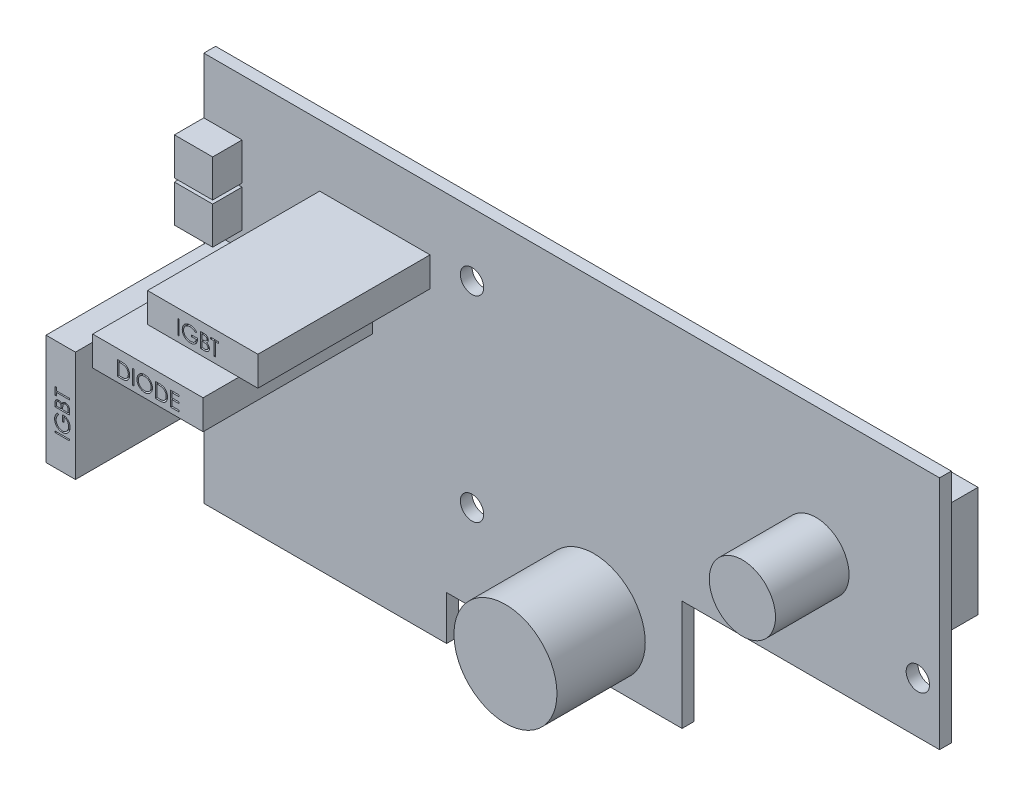
from build123d import *

# Parameters (mm, degrees)
BOSS_EXTRUDE1_DEPTH = 1.6
SKETCH2_W           = 5
SKETCH2_H           = 15
BOSS_EXTRUDE2_DEPTH = 10
SKETCH3_R           = 1.5875
CUT_EXTRUDE1_DEPTH  = 114.769767513
SKETCH4_R           = 4.5
BOSS_EXTRUDE3_DEPTH = 10
SKETCH5_R           = 7
BOSS_EXTRUDE4_DEPTH = 12
SKETCH6_W           = 15
SKETCH6_H           = 4
SKETCH6_W_2         = 4
SKETCH6_H_2         = 15
BOSS_EXTRUDE5_DEPTH = 23.4
SKETCH7_W           = 0.179487179
SKETCH7_H           = 2
CUT_EXTRUDE2_DEPTH  = 1
SKETCH8_W           = 2
SKETCH8_H           = 0.17948718
CUT_EXTRUDE3_DEPTH  = 1
SKETCH9_W           = 15
SKETCH9_H           = 4
BOSS_EXTRUDE6_DEPTH = 23
SKETCH10_W          = 0.17948718
SKETCH10_H          = 2
CUT_EXTRUDE4_DEPTH  = 1
SKETCH11_W          = 5.2
SKETCH11_H          = 5.075
BOSS_EXTRUDE7_DEPTH = 4
CUT_EXTRUDE5_DEPTH  = 1


with BuildPart() as part:
    # Sketch1 → Boss-Extrude1 (new body)
    with BuildSketch(Plane.XY):
        Polygon((33, -53), (33, -47), (65, -47), (65, -32), (100, -32), (100, 0), (65, 0), (33, 0), (0, 0), (0, -53), align=None)
    extrude(amount=BOSS_EXTRUDE1_DEPTH)

    # Sketch2 → Boss-Extrude2 (add)
    with BuildSketch(Plane(origin=(0, 0, 0), x_dir=(-1, 0, 0), z_dir=(0, 0, -1))):
        with Locations((-91.125, -17.6)):
            Rectangle(SKETCH2_W, SKETCH2_H)
    extrude(amount=BOSS_EXTRUDE2_DEPTH)

    # Sketch3 → Cut-Extrude1 (cut, through all)
    with BuildSketch(Plane.XY.offset(1.6)):
        with Locations((97.05, -25.05)):
            Circle(SKETCH3_R)
        with Locations((36.45, -8.6)):
            Circle(SKETCH3_R)
        with Locations((36.45, -35.276)):
            Circle(SKETCH3_R)
    extrude(amount=-CUT_EXTRUDE1_DEPTH, mode=Mode.SUBTRACT)

    # Sketch4 → Boss-Extrude3 (add)
    with BuildSketch(Plane.XY.offset(1.6)):
        with Locations((83.2, -17.55)):
            Circle(SKETCH4_R)
    extrude(amount=BOSS_EXTRUDE3_DEPTH)

    # Sketch5 → Boss-Extrude4 (add)
    with BuildSketch(Plane.XY.offset(1.6)):
        with Locations((53, -39.4)):
            Circle(SKETCH5_R)
    extrude(amount=BOSS_EXTRUDE4_DEPTH)

    # Sketch6 → Boss-Extrude5 (add)
    with BuildSketch(Plane.XY.offset(1.6)):
        with Locations((23.25, -10.374)):
            Rectangle(SKETCH6_W, SKETCH6_H)
        with Locations((3.95, -28.026)):
            Rectangle(SKETCH6_W_2, SKETCH6_H_2)
    extrude(amount=BOSS_EXTRUDE5_DEPTH)

    # Sketch7 → Cut-Extrude2 (cut)
    # profile 1 of 4: a face of its own
    with BuildSketch(Plane.XY.offset(25)):
        with Locations((19.967129928, -10.584645083)):
            Rectangle(SKETCH7_W, SKETCH7_H)
    # profile 2 of 4: a face of its own
    with BuildSketch(Plane.XY.offset(25)):
        with BuildLine():
            Line((22.441488902, -9.925991236), (22.287642748, -10.07182457))
            add(Edge.make_bspline(
                [(22.287642748, -10.07182457), (22.259803383, -10.045635505), (22.2047885, -9.993881869), (22.115096932, -9.926732729), (22.021517713, -9.869209243), (21.924539143, -9.82240568), (21.826562827, -9.785061245), (21.72888924, -9.758473736), (21.632520268, -9.741518001), (21.568424715, -9.739490361), (21.536841466, -9.738491236)],
                knots=[0, 0, 0, 0, 1.08915593, 2.152340314, 3.188132944, 4.216796309, 5.218260357, 6.173443236, 7.099959455, 8, 8, 8, 8], degree=3))
            add(Edge.make_bspline(
                [(21.536841466, -9.738491236), (21.517461637, -9.738727583), (21.478752243, -9.739199662), (21.421253989, -9.745224928), (21.364358768, -9.753890565), (21.308173982, -9.76642878), (21.25259039, -9.782319672), (21.197801309, -9.802197079), (21.143704535, -9.825371504), (21.090809631, -9.852150061), (21.039529343, -9.881567116), (20.991096866, -9.914166282), (20.945203495, -9.948902733), (20.902711824, -9.98664615), (20.863377431, -10.027054645), (20.826264076, -10.069376534), (20.79267705, -10.114768087), (20.762339241, -10.162394159), (20.735275459, -10.211418268), (20.7113848, -10.261368547), (20.691329321, -10.312079321), (20.675461061, -10.363614223), (20.662369259, -10.41557456), (20.653159197, -10.468320114), (20.647966785, -10.521907363), (20.647068625, -10.557791511), (20.646617107, -10.57583098)],
                knots=[0, 0, 0, 0, 1.02818874, 2.053710826, 3.065248034, 4.081641283, 5.106893873, 6.131558223, 7.173050175, 8.228653731, 9.27666206, 10.308777013, 11.325269123, 12.329503258, 13.32196095, 14.316845687, 15.314881793, 16.315733098, 17.311955233, 18.285320748, 19.252783886, 20.203351036, 21.145449891, 22.095197417, 23.042428769, 24, 24, 24, 24], degree=3))
            add(Edge.make_bspline(
                [(20.646617107, -10.57583098), (20.647048946, -10.594271447), (20.647911445, -10.631102026), (20.653431627, -10.686070068), (20.663676336, -10.740221726), (20.67737217, -10.793734945), (20.694504065, -10.846701373), (20.715859874, -10.898891378), (20.741154503, -10.95030303), (20.770432532, -11.000473097), (20.802538934, -11.049343396), (20.838506409, -11.095377409), (20.876712457, -11.139188138), (20.918548971, -11.179802861), (20.962674424, -11.218307944), (21.010407153, -11.253642528), (21.060808559, -11.286487227), (21.113955537, -11.316428095), (21.169271413, -11.34317583), (21.225989557, -11.366960914), (21.284291166, -11.386549106), (21.343869846, -11.402513737), (21.404654573, -11.415599621), (21.466953889, -11.424018181), (21.530309722, -11.430127228), (21.573017512, -11.430573896), (21.594533774, -11.430798929)],
                knots=[0, 0, 0, 0, 0.93586088, 1.869166235, 2.799637598, 3.729985548, 4.670839027, 5.622275134, 6.589130586, 7.576015415, 8.568469353, 9.55398029, 10.53834874, 11.515998671, 12.510579167, 13.508179873, 14.527009472, 15.561807829, 16.601455013, 17.643573243, 18.680854198, 19.719860599, 20.772568776, 21.833555941, 22.908541556, 24, 24, 24, 24], degree=3))
            add(Edge.make_bspline(
                [(21.594533774, -11.430798929), (21.620464258, -11.430256885), (21.671382976, -11.429192494), (21.746232372, -11.420906615), (21.818119841, -11.40796559), (21.886843386, -11.389013649), (21.952482826, -11.36484012), (22.015278793, -11.3356999), (22.074736883, -11.300475294), (22.13103584, -11.260718799), (22.182897088, -11.216424609), (22.229670874, -11.168627777), (22.270611153, -11.117560311), (22.306328124, -11.063522988), (22.335875927, -11.006068528), (22.360128952, -10.945478492), (22.378719405, -10.881725628), (22.386350819, -10.837673267), (22.390206851, -10.815414313)],
                knots=[0, 0, 0, 0, 1.13008108, 2.219097802, 3.278683437, 4.311054135, 5.322181354, 6.324827112, 7.324222904, 8.330512327, 9.32562643, 10.293043162, 11.24128371, 12.174520618, 13.111833804, 14.052305215, 15.015860969, 16, 16, 16, 16], degree=3))
            Line((22.390206851, -10.815414313), (21.723540184, -10.815414313))
            Line((21.723540184, -10.815414313), (21.723540184, -10.610286108))
            Line((21.723540184, -10.610286108), (22.56969403, -10.610286108))
            add(Edge.make_bspline(
                [(22.56969403, -10.610286108), (22.56871926, -10.648518959), (22.566811458, -10.723347554), (22.55342922, -10.832473423), (22.531819784, -10.935542962), (22.502299606, -11.032664718), (22.46408516, -11.123701056), (22.417586573, -11.208744408), (22.362059646, -11.287245369), (22.299482251, -11.3598448), (22.229253704, -11.424604349), (22.153271635, -11.481522028), (22.071410511, -11.52946638), (21.983747763, -11.568472473), (21.890570373, -11.598914755), (21.791662727, -11.620498514), (21.687158955, -11.633429921), (21.615537997, -11.635082138), (21.578908774, -11.635927134)],
                knots=[0, 0, 0, 0, 1.140356446, 2.231883559, 3.274166699, 4.278491846, 5.25512956, 6.21435461, 7.1637429, 8.11826594, 9.068280886, 10.0076534, 10.945064095, 11.891975133, 12.864533718, 13.863980011, 14.907571808, 16, 16, 16, 16], degree=3))
            add(Edge.make_bspline(
                [(21.578908774, -11.635927134), (21.556331553, -11.635601922), (21.511801999, -11.634960499), (21.446035754, -11.630402014), (21.382082828, -11.623384542), (21.319952537, -11.612787329), (21.259416342, -11.599807526), (21.200776579, -11.583186544), (21.143809869, -11.563947288), (21.088428163, -11.542064046), (21.035134136, -11.516708813), (20.983690412, -11.488531876), (20.933812626, -11.457678527), (20.885840532, -11.423615187), (20.839524177, -11.386596638), (20.795162209, -11.346548685), (20.752506279, -11.303593759), (20.725786014, -11.273091468), (20.712322235, -11.257722006)],
                knots=[0, 0, 0, 0, 1.107784379, 2.184907829, 3.233506516, 4.263428166, 5.276301166, 6.270063455, 7.25232949, 8.225834625, 9.190232166, 10.146266622, 11.1027726, 12.066435141, 13.031522626, 14.010570082, 14.99756817, 16, 16, 16, 16], degree=3))
            add(Edge.make_bspline(
                [(20.712322235, -11.257722006), (20.692787417, -11.233338775), (20.654042038, -11.184977051), (20.604168806, -11.107491369), (20.561653719, -11.027261734), (20.52715782, -10.944064804), (20.500221771, -10.857978397), (20.480903912, -10.769112516), (20.469585461, -10.677352727), (20.467954868, -10.61525829), (20.467129927, -10.583843801)],
                knots=[0, 0, 0, 0, 1.023165419, 2.029347347, 3.013907458, 3.994755782, 4.975994455, 5.96558838, 6.970761222, 8, 8, 8, 8], degree=3))
            add(Edge.make_bspline(
                [(20.467129927, -10.583843801), (20.467434064, -10.560320228), (20.46803847, -10.513572052), (20.475367337, -10.444167876), (20.485882433, -10.375996052), (20.501337892, -10.309112306), (20.520821472, -10.243471968), (20.54513775, -10.17904456), (20.573449119, -10.115792062), (20.606355117, -10.054149851), (20.642974808, -9.994935901), (20.682717791, -9.938388585), (20.72614842, -9.885537691), (20.772557448, -9.835713892), (20.822498585, -9.789543122), (20.87550397, -9.746597916), (20.931614452, -9.706820667), (20.991006555, -9.670837904), (21.052793803, -9.638515835), (21.11682809, -9.610179143), (21.183089867, -9.586760105), (21.251082712, -9.566889374), (21.321321283, -9.552195008), (21.393295876, -9.541538582), (21.467381654, -9.534246811), (21.517459385, -9.533660379), (21.542851081, -9.533363031)],
                knots=[0, 0, 0, 0, 1.008945113, 2.00506715, 2.99143336, 3.967273523, 4.948097931, 5.927297278, 6.919902385, 7.919676788, 8.923139349, 9.905703106, 10.883022732, 11.856032218, 12.825136022, 13.798837087, 14.781400844, 15.773989409, 16.776158564, 17.77167057, 18.775803737, 19.789618931, 20.80898985, 21.851988756, 22.910860228, 24, 24, 24, 24], degree=3))
            add(Edge.make_bspline(
                [(21.542851081, -9.533363031), (21.563558649, -9.533694169), (21.604619323, -9.534350778), (21.665719741, -9.538902005), (21.72587575, -9.546115651), (21.785176544, -9.555959529), (21.843420182, -9.569367353), (21.900772585, -9.585412087), (21.957316891, -9.604093128), (22.012875891, -9.626372469), (22.067823157, -9.651660255), (22.122464209, -9.680125067), (22.176612349, -9.712253641), (22.230361481, -9.748141376), (22.284050543, -9.7871719), (22.336830339, -9.830461514), (22.389974878, -9.876303089), (22.424147344, -9.909264337), (22.441488902, -9.925991236)],
                knots=[0, 0, 0, 0, 0.985871117, 1.954866573, 2.915460327, 3.869826059, 4.81536089, 5.759505086, 6.70452669, 7.649098992, 8.607881297, 9.583363685, 10.581137262, 11.603961102, 12.659522466, 13.73993555, 14.853081303, 16, 16, 16, 16], degree=3))
        make_face()
    # profile 3 of 4: a face of its own
    with BuildSketch(Plane.XY.offset(25)):
        with BuildLine():
            Line((22.97995044, -9.584645083), (23.370174799, -9.584645083))
            add(Edge.make_bspline(
                [(23.370174799, -9.584645083), (23.389276787, -9.584745511), (23.426301193, -9.584940167), (23.480140874, -9.5879591), (23.530568766, -9.592075482), (23.577599493, -9.598606964), (23.621211323, -9.606487979), (23.661535687, -9.616031874), (23.698444357, -9.627475653), (23.742508777, -9.645673528), (23.792749155, -9.672715339), (23.847148237, -9.712674519), (23.893664945, -9.761550212), (23.933771412, -9.816683158), (23.965657766, -9.877332171), (23.988725936, -9.942051707), (24.003330436, -10.010006988), (24.004832398, -10.056660233), (24.005591466, -10.080238031)],
                knots=[0, 0, 0, 0, 1.001505555, 1.941167018, 2.826882275, 3.653841531, 4.429895133, 5.150066043, 5.825578002, 6.45369114, 7.647487171, 8.808567382, 9.977351308, 11.170798116, 12.373658725, 13.556498008, 14.765093433, 16, 16, 16, 16], degree=3))
            add(Edge.make_bspline(
                [(24.005591466, -10.080238031), (24.00496677, -10.102325206), (24.003739183, -10.145728587), (23.992000463, -10.209210935), (23.973622938, -10.269640203), (23.948077082, -10.326795852), (23.914875941, -10.379386488), (23.87552833, -10.427836354), (23.828055872, -10.470094101), (23.792488306, -10.493718617), (23.774421594, -10.505718801)],
                knots=[0, 0, 0, 0, 1.044552857, 2.05264487, 3.044412934, 4.028983338, 5.005914585, 5.980388656, 6.974128949, 8, 8, 8, 8], degree=3))
            add(Edge.make_bspline(
                [(23.774421594, -10.505718801), (23.797141838, -10.514441657), (23.840611294, -10.531130642), (23.900431873, -10.560636622), (23.951971784, -10.592729256), (23.995627296, -10.627776028), (24.032963099, -10.665552491), (24.06556478, -10.706612557), (24.093382708, -10.751491847), (24.117218664, -10.799722438), (24.135817953, -10.850811849), (24.149747042, -10.904280864), (24.157728441, -10.959937752), (24.158864236, -10.997815112), (24.15943762, -11.016936749)],
                knots=[0, 0, 0, 0, 1.27268992, 2.434971085, 3.483601985, 4.442670788, 5.356604649, 6.2567628, 7.179492994, 8.113709626, 9.066344395, 10.018646069, 10.999752585, 12, 12, 12, 12], degree=3))
            add(Edge.make_bspline(
                [(24.15943762, -11.016936749), (24.158879422, -11.036460676), (24.157781152, -11.074874549), (24.149678311, -11.131306055), (24.135958822, -11.185234596), (24.117061024, -11.237008986), (24.092396844, -11.286529063), (24.062380864, -11.333850928), (24.026591399, -11.378499117), (23.986555474, -11.420969759), (23.94126282, -11.459157066), (23.892396674, -11.493166041), (23.839341634, -11.521135219), (23.782969066, -11.544630089), (23.7226466, -11.562577059), (23.65864511, -11.575132816), (23.591019794, -11.583592837), (23.544614222, -11.584288383), (23.520815825, -11.584645083)],
                knots=[0, 0, 0, 0, 0.978564426, 1.925352924, 2.850884081, 3.763762016, 4.682927383, 5.618979971, 6.567305752, 7.547517671, 8.540179244, 9.531824382, 10.526200242, 11.540722885, 12.589160233, 13.674978461, 14.80764778, 16, 16, 16, 16], degree=3))
            Line((23.520815825, -11.584645083), (22.97995044, -11.584645083))
            Line((22.97995044, -11.584645083), (22.97995044, -9.584645083))
        make_face()
        with BuildLine():
            Line((23.15943762, -9.789773288), (23.15943762, -10.430798929))
            Line((23.15943762, -10.430798929), (23.280030568, -10.430798929))
            add(Edge.make_bspline(
                [(23.280030568, -10.430798929), (23.297658452, -10.430570401), (23.331719114, -10.43012884), (23.381044769, -10.428863973), (23.426830494, -10.425322234), (23.468997256, -10.421781513), (23.507478652, -10.416024605), (23.54218943, -10.409171964), (23.573674343, -10.401924589), (23.609982654, -10.389599168), (23.651167196, -10.371383354), (23.695071827, -10.343113733), (23.733777239, -10.309442674), (23.766461346, -10.270590696), (23.793210758, -10.227810019), (23.811790023, -10.18178323), (23.824388471, -10.13365744), (23.825526489, -10.100618438), (23.826104286, -10.083843801)],
                knots=[0, 0, 0, 0, 1.156816544, 2.235205308, 3.236616184, 4.169592532, 5.011045266, 5.787822928, 6.49130361, 7.128639758, 8.301311294, 9.436451833, 10.541879658, 11.654887649, 12.756523258, 13.837046038, 14.901820046, 16, 16, 16, 16], degree=3))
            add(Edge.make_bspline(
                [(23.826104286, -10.083843801), (23.825803612, -10.07274336), (23.825213806, -10.050968633), (23.820383348, -10.019226145), (23.812173305, -9.989372572), (23.801627995, -9.960998795), (23.786891601, -9.934992023), (23.769541051, -9.910453054), (23.748577799, -9.888217558), (23.724716478, -9.867434987), (23.697282979, -9.849009543), (23.666293669, -9.832871964), (23.631329282, -9.819877234), (23.59297908, -9.808496576), (23.550652744, -9.800503265), (23.504838713, -9.793844186), (23.455161731, -9.790454048), (23.420793101, -9.790005269), (23.403027363, -9.789773288)],
                knots=[0, 0, 0, 0, 0.91205012, 1.789085906, 2.630437955, 3.453916878, 4.269457761, 5.079663411, 5.91843418, 6.774407191, 7.675494373, 8.627863946, 9.638891023, 10.736472738, 11.911756761, 13.175263542, 14.539845004, 16, 16, 16, 16], degree=3))
            Line((23.403027363, -9.789773288), (23.15943762, -9.789773288))
        make_face(mode=Mode.SUBTRACT)
        with BuildLine():
            Line((23.15943762, -10.635927134), (23.15943762, -11.379516878))
            Line((23.15943762, -11.379516878), (23.415046594, -11.379516878))
            add(Edge.make_bspline(
                [(23.415046594, -11.379516878), (23.433343123, -11.379297593), (23.468607271, -11.378874952), (23.51952226, -11.377495206), (23.566712605, -11.374356763), (23.609962968, -11.369416278), (23.649740369, -11.364057164), (23.685567628, -11.356850718), (23.717735167, -11.348594169), (23.755034772, -11.335831785), (23.797036777, -11.31600523), (23.842300123, -11.286111386), (23.882543676, -11.250498067), (23.91671811, -11.209280402), (23.944725532, -11.164462501), (23.965100078, -11.116950872), (23.977666282, -11.067530571), (23.979187521, -11.033835307), (23.97995044, -11.016936749)],
                knots=[0, 0, 0, 0, 1.160039823, 2.235823828, 3.228722157, 4.157150951, 4.99529583, 5.772374946, 6.472645482, 7.099169577, 8.269452708, 9.405989375, 10.527446681, 11.663510218, 12.788923519, 13.866172445, 14.929861265, 16, 16, 16, 16], degree=3))
            add(Edge.make_bspline(
                [(23.97995044, -11.016936749), (23.979792666, -11.006369126), (23.979479663, -10.985404337), (23.974759312, -10.954595297), (23.967894244, -10.924751941), (23.959019139, -10.895793232), (23.946093729, -10.868242731), (23.931004274, -10.841555554), (23.913312045, -10.815696423), (23.88574395, -10.783003707), (23.845645673, -10.745336842), (23.788670373, -10.70845827), (23.723886203, -10.678716666), (23.676899064, -10.666088394), (23.652626722, -10.659564954)],
                knots=[0, 0, 0, 0, 0.723448775, 1.435228256, 2.130040452, 2.821711965, 3.505591119, 4.210454504, 4.921174351, 5.648778258, 7.137944449, 8.670945889, 10.280296675, 12, 12, 12, 12], degree=3))
            add(Edge.make_bspline(
                [(23.652626722, -10.659564954), (23.64289581, -10.657590621), (23.621797186, -10.653309858), (23.587392855, -10.64879117), (23.548115215, -10.644765422), (23.503873571, -10.641787618), (23.454611948, -10.638709593), (23.400225137, -10.637512552), (23.340935243, -10.636084403), (23.299796744, -10.635980898), (23.278428004, -10.635927134)],
                knots=[0, 0, 0, 0, 0.634451884, 1.375622551, 2.216452059, 3.157844607, 4.20941857, 5.370758133, 6.634282058, 8, 8, 8, 8], degree=3))
            Line((23.278428004, -10.635927134), (23.15943762, -10.635927134))
        make_face(mode=Mode.SUBTRACT)
    # profile 4 of 4: a face of its own
    with BuildSketch(Plane.XY.offset(25)):
        Polygon((24.338924799, -9.789773288), (24.338924799, -9.584645083), (25.390206851, -9.584645083), (25.390206851, -9.789773288), (24.954309415, -9.789773288), (24.954309415, -11.584645083), (24.774822235, -11.584645083), (24.774822235, -9.789773288), align=None)
    extrude(amount=-CUT_EXTRUDE2_DEPTH, mode=Mode.SUBTRACT)

    # Sketch8 → Cut-Extrude3 (cut)
    # profile 1 of 4: a face of its own
    with BuildSketch(Plane.XY.offset(25)):
        with Locations((4.170888844, -31.284478919)):
            Rectangle(SKETCH8_W, SKETCH8_H)
    # profile 2 of 4: a face of its own
    with BuildSketch(Plane.XY.offset(25)):
        with BuildLine():
            Line((3.512234998, -28.887043021), (3.658068331, -29.040889175))
            add(Edge.make_bspline(
                [(3.658068331, -29.040889175), (3.63187049, -29.068722935), (3.58009951, -29.123726744), (3.513035087, -29.213555283), (3.455016271, -29.306901484), (3.408161648, -29.403916284), (3.371406413, -29.502055713), (3.34468872, -29.599632258), (3.327768629, -29.696014142), (3.325736389, -29.76010803), (3.324734998, -29.791690457)],
                knots=[0, 0, 0, 0, 1.089067066, 2.152164705, 3.18986567, 4.218445106, 5.218487318, 6.173592265, 7.100032889, 8, 8, 8, 8], degree=3))
            add(Edge.make_bspline(
                [(3.324734998, -29.791690457), (3.324971344, -29.811070286), (3.325443424, -29.84977968), (3.33146869, -29.907277934), (3.340134326, -29.964173155), (3.352672542, -30.020357941), (3.368563433, -30.075941534), (3.388440842, -30.130730612), (3.41161526, -30.184827396), (3.438393843, -30.237722264), (3.467810801, -30.289002683), (3.500410322, -30.337434681), (3.535145479, -30.383329802), (3.572893636, -30.425815063), (3.613284666, -30.465173071), (3.655591162, -30.502127757), (3.700644917, -30.535990373), (3.748260661, -30.566153596), (3.797330634, -30.593392221), (3.847438676, -30.616930621), (3.898119619, -30.637393452), (3.949755085, -30.652978573), (4.001812732, -30.666179072), (4.054565367, -30.67536835), (4.108150748, -30.680566245), (4.144035146, -30.681463669), (4.162074742, -30.681914816)],
                knots=[0, 0, 0, 0, 1.028150113, 2.053633673, 3.06513288, 4.081487945, 5.106702018, 6.131327874, 7.172780699, 8.228344599, 9.276313556, 10.308389736, 11.324843658, 12.329040066, 13.321460474, 14.316307835, 15.308626991, 16.309440696, 17.305625405, 18.28535951, 19.246194545, 20.203493668, 21.145557131, 22.095268976, 23.042464743, 24, 24, 24, 24], degree=3))
            add(Edge.make_bspline(
                [(4.162074742, -30.681914816), (4.180515119, -30.681482705), (4.217345521, -30.680619662), (4.272314893, -30.675103549), (4.326461512, -30.664843429), (4.379870542, -30.651236715), (4.432648277, -30.633938043), (4.484739639, -30.612685178), (4.536139563, -30.587367388), (4.586337802, -30.558126663), (4.63519502, -30.525835538), (4.681602151, -30.490320576), (4.725019133, -30.451521984), (4.766080128, -30.410151159), (4.804526002, -30.365831161), (4.839893346, -30.318132), (4.872729048, -30.267721376), (4.902672383, -30.214576925), (4.92941945, -30.159260365), (4.953204713, -30.102542405), (4.972792858, -30.044240747), (4.988757501, -29.98466208), (5.001843382, -29.92387735), (5.010261943, -29.861578035), (5.016370989, -29.798222201), (5.016817658, -29.755514411), (5.01704269, -29.73399815)],
                knots=[0, 0, 0, 0, 0.935915162, 1.869274651, 2.799799983, 3.730201895, 4.664668062, 5.616159355, 6.583070886, 7.570012957, 8.562524459, 9.553461134, 10.53281078, 11.515274572, 12.509912756, 13.507571325, 14.526460018, 15.561318395, 16.601025881, 17.643204557, 18.680545676, 19.719612342, 20.772381578, 21.833430283, 22.908478249, 24, 24, 24, 24], degree=3))
            add(Edge.make_bspline(
                [(5.01704269, -29.73399815), (5.016500871, -29.70806756), (5.015436922, -29.657148634), (5.007147853, -29.582300737), (4.994218441, -29.510407812), (4.975224698, -29.441703905), (4.951183298, -29.375939679), (4.921452681, -29.313357686), (4.886345662, -29.253785118), (4.846573151, -29.197479826), (4.802259742, -29.145780386), (4.75486848, -29.09872777), (4.703785377, -29.057939985), (4.649771748, -29.022198661), (4.592310944, -28.992657379), (4.531722622, -28.968402592), (4.467969294, -28.949812617), (4.423916996, -28.942181137), (4.401658075, -28.938325073)],
                knots=[0, 0, 0, 0, 1.130199668, 2.219330667, 3.279027493, 4.311506524, 5.322739849, 6.327972234, 7.327472899, 8.33386792, 9.329086447, 10.29244429, 11.240784345, 12.174119183, 13.111530729, 14.052100829, 15.015757696, 16, 16, 16, 16], degree=3))
            Line((4.401658075, -28.938325073), (4.401658075, -29.604991739))
            Line((4.401658075, -29.604991739), (4.19652987, -29.604991739))
            Line((4.19652987, -29.604991739), (4.19652987, -28.758837893))
            add(Edge.make_bspline(
                [(4.19652987, -28.758837893), (4.23476272, -28.759812664), (4.309591316, -28.761720466), (4.418717185, -28.775102703), (4.521786724, -28.796712139), (4.618908479, -28.826232317), (4.709944818, -28.864446763), (4.79498817, -28.910945351), (4.87348913, -28.966472277), (4.946088561, -29.029049672), (5.010848111, -29.099278219), (5.06776579, -29.175260288), (5.115710141, -29.257121413), (5.154716234, -29.34478416), (5.185158517, -29.43796155), (5.206742275, -29.536869196), (5.219673683, -29.641372968), (5.221325899, -29.712993926), (5.222170895, -29.74962315)],
                knots=[0, 0, 0, 0, 1.140356446, 2.231883559, 3.274166699, 4.278491846, 5.25512956, 6.21435461, 7.1637429, 8.11826594, 9.068280886, 10.0076534, 10.945064095, 11.891975133, 12.864533718, 13.863980011, 14.907571808, 16, 16, 16, 16], degree=3))
            add(Edge.make_bspline(
                [(5.222170895, -29.74962315), (5.221845683, -29.77220037), (5.22120426, -29.816729925), (5.216645776, -29.882496169), (5.209628304, -29.946449095), (5.19903109, -30.008579386), (5.186051288, -30.069115582), (5.169430306, -30.127755344), (5.150191049, -30.184722054), (5.128307807, -30.24010376), (5.102952575, -30.293397787), (5.074775638, -30.344841511), (5.043922289, -30.394719297), (5.009858948, -30.442691391), (4.9728404, -30.489007746), (4.932792446, -30.533369714), (4.88983752, -30.576025645), (4.859335229, -30.602745909), (4.843965767, -30.616209688)],
                knots=[0, 0, 0, 0, 1.107784379, 2.184907829, 3.233506516, 4.263428166, 5.276301166, 6.270063455, 7.25232949, 8.225834625, 9.190232166, 10.146266622, 11.1027726, 12.066435141, 13.031522626, 14.010570082, 14.99756817, 16, 16, 16, 16], degree=3))
            add(Edge.make_bspline(
                [(4.843965767, -30.616209688), (4.819582537, -30.635744506), (4.771220813, -30.674489885), (4.69373513, -30.724363117), (4.613505496, -30.766878205), (4.530308565, -30.801374103), (4.444222158, -30.828310152), (4.355356277, -30.847628011), (4.263596488, -30.858946462), (4.201502051, -30.860577055), (4.170087562, -30.861401996)],
                knots=[0, 0, 0, 0, 1.023165419, 2.029347347, 3.013907458, 3.994755782, 4.975994455, 5.96558838, 6.970761222, 8, 8, 8, 8], degree=3))
            add(Edge.make_bspline(
                [(4.170087562, -30.861401996), (4.146563989, -30.86109786), (4.099815813, -30.860493453), (4.030411638, -30.853164586), (3.962239811, -30.842649493), (3.895356076, -30.827194021), (3.829715695, -30.807710486), (3.76528845, -30.78339404), (3.702035334, -30.75508331), (3.640395456, -30.7221749), (3.581172819, -30.685564193), (3.524657236, -30.64578839), (3.471764654, -30.60254057), (3.422372546, -30.555694802), (3.375748858, -30.506195413), (3.332867487, -30.453003241), (3.293057409, -30.396924192), (3.257083575, -30.33752354), (3.224759087, -30.275738608), (3.196423042, -30.211703702), (3.17300383, -30.145442092), (3.153133146, -30.077449202), (3.138438767, -30.007210642), (3.127782344, -29.935236047), (3.120490572, -29.861150269), (3.11990414, -29.811072538), (3.119606793, -29.785680842)],
                knots=[0, 0, 0, 0, 1.00895651, 2.005089799, 2.991467152, 3.967318338, 4.948153826, 5.927364234, 6.919980553, 7.91976625, 8.923240147, 9.905815003, 10.88314567, 11.851989312, 12.825009789, 13.798721852, 14.781296708, 15.773896486, 16.776076962, 17.771600213, 18.775744723, 19.78957137, 20.808953803, 21.851964491, 22.910847925, 24, 24, 24, 24], degree=3))
            add(Edge.make_bspline(
                [(3.119606793, -29.785680842), (3.119937931, -29.764973274), (3.120594539, -29.723912601), (3.125145766, -29.662812182), (3.132359413, -29.602656174), (3.142203291, -29.543355379), (3.155611114, -29.485111742), (3.171655848, -29.427759339), (3.19033689, -29.371215032), (3.21261623, -29.315656033), (3.237904016, -29.260708766), (3.266368829, -29.206067715), (3.298497403, -29.151919574), (3.334385137, -29.098170442), (3.373415662, -29.04448138), (3.416705275, -28.991701584), (3.46254685, -28.938557045), (3.495508098, -28.90438458), (3.512234998, -28.887043021)],
                knots=[0, 0, 0, 0, 0.985871117, 1.954866573, 2.915460327, 3.869826059, 4.81536089, 5.759505086, 6.70452669, 7.649098992, 8.607881297, 9.583363685, 10.581137262, 11.603961102, 12.659522466, 13.73993555, 14.853081303, 16, 16, 16, 16], degree=3))
        make_face()
    # profile 3 of 4: a face of its own
    with BuildSketch(Plane.XY.offset(25)):
        with BuildLine():
            Line((3.170888844, -28.348581483), (3.170888844, -27.958357124))
            add(Edge.make_bspline(
                [(3.170888844, -27.958357124), (3.170987692, -27.939254835), (3.171179283, -27.902229845), (3.174219702, -27.848394258), (3.178261652, -27.797952184), (3.185041804, -27.75099276), (3.192071928, -27.707210428), (3.202390467, -27.667049671), (3.213787669, -27.630174092), (3.231323811, -27.58589407), (3.258557661, -27.535652317), (3.298948048, -27.481651834), (3.347372861, -27.434711319), (3.402556755, -27.394797967), (3.463265291, -27.362766654), (3.528192307, -27.339886577), (3.596245482, -27.325187544), (3.642902226, -27.323694844), (3.666481793, -27.322940457)],
                knots=[0, 0, 0, 0, 1.00128172, 1.940733171, 2.826250472, 3.653024905, 4.427672124, 5.149348099, 5.824709082, 6.450061444, 7.643590664, 8.808605388, 9.972104426, 11.165284501, 12.367876273, 13.557044126, 14.765369432, 16, 16, 16, 16], degree=3))
            add(Edge.make_bspline(
                [(3.666481793, -27.322940457), (3.688567996, -27.323568806), (3.731969469, -27.324803571), (3.795339664, -27.336466983), (3.855601014, -27.354978484), (3.912701946, -27.380562126), (3.965579521, -27.413525216), (4.014069937, -27.453019632), (4.056340525, -27.500471857), (4.079963275, -27.536042204), (4.091962562, -27.554110329)],
                knots=[0, 0, 0, 0, 1.044641374, 2.052818814, 3.038628718, 4.023282556, 5.005660861, 5.98021751, 6.974042014, 8, 8, 8, 8], degree=3))
            add(Edge.make_bspline(
                [(4.091962562, -27.554110329), (4.100688243, -27.531392279), (4.117382632, -27.48792702), (4.146851968, -27.428077979), (4.179020564, -27.376702272), (4.21360755, -27.332796302), (4.251438481, -27.295443686), (4.292820715, -27.263094161), (4.337720374, -27.235127366), (4.385972438, -27.211327817), (4.437167853, -27.192632974), (4.490681315, -27.178892524), (4.546307683, -27.170764749), (4.58405685, -27.169655996), (4.603180511, -27.169094303)],
                knots=[0, 0, 0, 0, 1.272586185, 2.434772614, 3.483318042, 4.437947805, 5.351807173, 6.25737843, 7.180033415, 8.1141739, 9.066731021, 10.025721652, 10.999834114, 12, 12, 12, 12], degree=3))
            add(Edge.make_bspline(
                [(4.603180511, -27.169094303), (4.622704517, -27.169652379), (4.661118547, -27.170750409), (4.717548917, -27.178854992), (4.771481629, -27.192568078), (4.823240674, -27.21148944), (4.872717533, -27.236014675), (4.919732967, -27.26629245), (4.964384791, -27.301897727), (5.00675181, -27.342137445), (5.045518964, -27.386981462), (5.078845643, -27.436402456), (5.107501837, -27.489046531), (5.130832689, -27.545586692), (5.148832425, -27.605878604), (5.161373291, -27.669888716), (5.169837486, -27.737511615), (5.170532445, -27.783917527), (5.170888844, -27.807716098)],
                knots=[0, 0, 0, 0, 0.978680899, 1.925582087, 2.851223405, 3.764209995, 4.683484765, 5.614004905, 6.562443559, 7.542772147, 8.539900013, 9.527881485, 10.525548727, 11.540192123, 12.58875426, 13.674701727, 14.807505862, 16, 16, 16, 16], degree=3))
            Line((5.170888844, -27.807716098), (5.170888844, -28.348581483))
            Line((5.170888844, -28.348581483), (3.170888844, -28.348581483))
        make_face()
        with BuildLine():
            Line((3.376017049, -28.169094303), (4.01704269, -28.169094303))
            Line((4.01704269, -28.169094303), (4.01704269, -28.048501355))
            add(Edge.make_bspline(
                [(4.01704269, -28.048501355), (4.016814163, -28.030873472), (4.016372601, -27.996812809), (4.015107734, -27.947487154), (4.011565996, -27.901701428), (4.00802527, -27.859534672), (4.002268379, -27.821053257), (3.995415684, -27.786342541), (3.988168483, -27.754857427), (3.975842331, -27.718549965), (3.957631474, -27.677359656), (3.929342271, -27.633477809), (3.895674548, -27.594612771), (3.856463281, -27.562186999), (3.813755315, -27.535414682), (3.767925588, -27.516659832), (3.719896363, -27.504156532), (3.686860571, -27.503009839), (3.670087562, -27.502427637)],
                knots=[0, 0, 0, 0, 1.156917035, 2.235399477, 3.236897345, 4.169954739, 5.01148057, 5.788325709, 6.491867502, 7.129259015, 8.302032419, 9.437271567, 10.542795419, 11.662606952, 12.764338259, 13.836858145, 14.901724648, 16, 16, 16, 16], degree=3))
            add(Edge.make_bspline(
                [(3.670087562, -27.502427637), (3.658985666, -27.502723243), (3.637208085, -27.503303107), (3.60535826, -27.508224721), (3.575431107, -27.516199041), (3.547139401, -27.526998419), (3.521186257, -27.541751974), (3.496331568, -27.558853281), (3.474064009, -27.579967274), (3.453311531, -27.60382796), (3.434738133, -27.63112884), (3.419352951, -27.662458113), (3.405408865, -27.69700587), (3.395086472, -27.735709408), (3.386009546, -27.777766779), (3.380306453, -27.823747454), (3.376636458, -27.873360064), (3.376228124, -27.907735371), (3.376017049, -27.92550456)],
                knots=[0, 0, 0, 0, 0.911708768, 1.788416306, 2.640049961, 3.452993646, 4.268229297, 5.087074648, 5.92553149, 6.781184137, 7.681934069, 8.628939405, 9.643570426, 10.73771997, 11.914765019, 13.176320755, 14.540391495, 16, 16, 16, 16], degree=3))
            Line((3.376017049, -27.92550456), (3.376017049, -28.169094303))
        make_face(mode=Mode.SUBTRACT)
        with BuildLine():
            Line((4.222170895, -28.169094303), (4.965760639, -28.169094303))
            Line((4.965760639, -28.169094303), (4.965760639, -27.913485329))
            add(Edge.make_bspline(
                [(4.965760639, -27.913485329), (4.96551955, -27.895190714), (4.965054884, -27.859930254), (4.963965145, -27.808980117), (4.959842829, -27.761880445), (4.95604001, -27.718482656), (4.949537354, -27.678901929), (4.943400537, -27.642833806), (4.93429087, -27.610870369), (4.921770706, -27.573465754), (4.901727476, -27.531656039), (4.872444508, -27.485965546), (4.836304803, -27.446124145), (4.795202734, -27.411924021), (4.750635548, -27.383700594), (4.703185877, -27.363447615), (4.653776526, -27.350861692), (4.620079801, -27.349343083), (4.603180511, -27.348581483)],
                knots=[0, 0, 0, 0, 1.160376723, 2.23647316, 3.230273494, 4.158083346, 4.997711197, 5.773399541, 6.476071462, 7.102777513, 8.27340052, 9.405620712, 10.53304798, 11.669441455, 12.787990954, 13.865552736, 14.929550474, 16, 16, 16, 16], degree=3))
            add(Edge.make_bspline(
                [(4.603180511, -27.348581483), (4.59261266, -27.348738774), (4.571647419, -27.349050818), (4.540841698, -27.353778214), (4.510986082, -27.360617257), (4.481956159, -27.369624474), (4.454240029, -27.382216077), (4.4277314, -27.397652327), (4.401896264, -27.415321858), (4.368812134, -27.442582603), (4.331166984, -27.482812507), (4.294765325, -27.539983691), (4.264934518, -27.604630428), (4.25232333, -27.65162765), (4.245808716, -27.675905201)],
                knots=[0, 0, 0, 0, 0.723302347, 1.434937762, 2.129609326, 2.821140842, 3.513216847, 4.209993937, 4.920569932, 5.655069131, 7.14393391, 8.6716197, 10.280644748, 12, 12, 12, 12], degree=3))
            add(Edge.make_bspline(
                [(4.245808716, -27.675905201), (4.243834382, -27.685636113), (4.23955362, -27.706734737), (4.235034932, -27.741139069), (4.231009183, -27.780416708), (4.228031379, -27.824658352), (4.224953354, -27.873919976), (4.223756313, -27.928306786), (4.222328165, -27.98759668), (4.22222466, -28.028735179), (4.222170895, -28.050103919)],
                knots=[0, 0, 0, 0, 0.634451884, 1.375622551, 2.216452059, 3.157844607, 4.20941857, 5.370758133, 6.634282058, 8, 8, 8, 8], degree=3))
            Line((4.222170895, -28.050103919), (4.222170895, -28.169094303))
        make_face(mode=Mode.SUBTRACT)
    # profile 4 of 4: a face of its own
    with BuildSketch(Plane.XY.offset(25)):
        Polygon((3.376017049, -26.989607124), (3.170888844, -26.989607124), (3.170888844, -25.938325073), (3.376017049, -25.938325073), (3.376017049, -26.374222509), (5.170888844, -26.374222509), (5.170888844, -26.553709688), (3.376017049, -26.553709688), align=None)
    extrude(amount=-CUT_EXTRUDE3_DEPTH, mode=Mode.SUBTRACT)

    # Sketch9 → Boss-Extrude6 (add)
    with BuildSketch(Plane.XY.offset(1.6)):
        with Locations((15.4, -19.625)):
            Rectangle(SKETCH9_W, SKETCH9_H)
    extrude(amount=BOSS_EXTRUDE6_DEPTH)

    # Sketch10 → Cut-Extrude4 (cut)
    # profile 1 of 5: a face of its own
    with BuildSketch(Plane.XY.offset(24.6)):
        with BuildLine():
            Line((11.270141014, -20.928922797), (11.270141014, -18.928922797))
            Line((11.270141014, -18.928922797), (11.673987168, -18.928922797))
            add(Edge.make_bspline(
                [(11.673987168, -18.928922797), (11.709112304, -18.929175694), (11.776973884, -18.92966429), (11.87503814, -18.932762227), (11.965771718, -18.938242494), (12.048876209, -18.94622508), (12.124579759, -18.956026813), (12.192670392, -18.968312759), (12.253500188, -18.982820285), (12.290911297, -18.995189113), (12.308602552, -19.001038181)],
                knots=[0, 0, 0, 0, 1.314313732, 2.53924729, 3.670748893, 4.714932338, 5.66265055, 6.526160246, 7.303039223, 8, 8, 8, 8], degree=3))
            add(Edge.make_bspline(
                [(12.308602552, -19.001038181), (12.331742404, -19.009855727), (12.377497371, -19.027290867), (12.442644298, -19.060180182), (12.503973077, -19.097444811), (12.561812588, -19.139133876), (12.614841632, -19.186427789), (12.665131858, -19.237317552), (12.710625986, -19.293653747), (12.75228787, -19.354268026), (12.789851104, -19.418446341), (12.822502051, -19.486066403), (12.849618619, -19.556784808), (12.872129034, -19.630404892), (12.889869867, -19.707088537), (12.901973828, -19.786925032), (12.90995725, -19.869598854), (12.910759565, -19.925698548), (12.911166655, -19.954163181)],
                knots=[0, 0, 0, 0, 0.984719456, 1.947108742, 2.898477687, 3.838006223, 4.779231079, 5.722358779, 6.681677486, 7.655904652, 8.64651281, 9.637519902, 10.640069247, 11.656948941, 12.698408672, 13.768548281, 14.867775369, 16, 16, 16, 16], degree=3))
            add(Edge.make_bspline(
                [(12.911166655, -19.954163181), (12.910807245, -19.978883889), (12.91009899, -20.027598625), (12.903739381, -20.099393423), (12.89449577, -20.169058321), (12.880184799, -20.236261578), (12.862811935, -20.301591988), (12.840546705, -20.364353271), (12.815040707, -20.425121162), (12.78529792, -20.483074005), (12.7526457, -20.537978789), (12.717604704, -20.589736234), (12.680212306, -20.637607789), (12.640111945, -20.681738425), (12.597821821, -20.722061612), (12.553065061, -20.758914193), (12.505726174, -20.791575081), (12.45601719, -20.821327714), (12.402487973, -20.847282203), (12.344124621, -20.869242209), (12.280678234, -20.887440275), (12.212304544, -20.902623644), (12.138885414, -20.914667817), (12.060348862, -20.922740041), (11.976815554, -20.92819886), (11.919455974, -20.928676799), (11.889932681, -20.928922797)],
                knots=[0, 0, 0, 0, 1.105936401, 2.179363191, 3.223086493, 4.248585256, 5.251745608, 6.245858792, 7.225916811, 8.198733463, 9.158002045, 10.082870192, 10.993790845, 11.873723703, 12.748670949, 13.606408763, 14.465103618, 15.319838547, 16.196477973, 17.123216899, 18.106603292, 19.147568657, 20.255746949, 21.433717677, 22.679120308, 24, 24, 24, 24], degree=3))
            Line((11.889932681, -20.928922797), (11.270141014, -20.928922797))
        make_face()
        with BuildLine():
            Line((11.449628193, -20.723794591), (11.679195501, -20.723794591))
            add(Edge.make_bspline(
                [(11.679195501, -20.723794591), (11.712183142, -20.723652822), (11.775630455, -20.723380148), (11.866863596, -20.72098746), (11.950223251, -20.717077782), (12.025721257, -20.711606309), (12.093314985, -20.7043671), (12.153145699, -20.696295727), (12.205017275, -20.686240041), (12.236405525, -20.677125207), (12.250910245, -20.672913181)],
                knots=[0, 0, 0, 0, 1.375205317, 2.645023457, 3.804390687, 4.853969522, 5.800190428, 6.637939096, 7.370582563, 8, 8, 8, 8], degree=3))
            add(Edge.make_bspline(
                [(12.250910245, -20.672913181), (12.269166452, -20.666483719), (12.305242816, -20.653778363), (12.357174865, -20.630602557), (12.405607439, -20.603149945), (12.451384596, -20.57263436), (12.493856971, -20.537979502), (12.533527895, -20.499938937), (12.570317495, -20.458319066), (12.603845671, -20.413171545), (12.633850417, -20.364777376), (12.659833976, -20.313612328), (12.68260628, -20.260237008), (12.700479761, -20.203831774), (12.714488667, -20.144900884), (12.724411346, -20.08344019), (12.730591188, -20.019461172), (12.731312015, -19.975945673), (12.731679476, -19.95376254)],
                knots=[0, 0, 0, 0, 0.998632004, 1.973411704, 2.929992603, 3.868527914, 4.809262121, 5.754881198, 6.702106254, 7.672490631, 8.653608572, 9.636854334, 10.631411391, 11.644891563, 12.686317036, 13.754757253, 14.855430412, 16, 16, 16, 16], degree=3))
            add(Edge.make_bspline(
                [(12.731679476, -19.95376254), (12.731386168, -19.93037198), (12.730809964, -19.884421017), (12.723567501, -19.816997763), (12.712983755, -19.752151677), (12.697678792, -19.689878422), (12.678175432, -19.630056507), (12.653835637, -19.573016787), (12.62602614, -19.518156862), (12.592938519, -19.466742938), (12.556701037, -19.418118305), (12.516485106, -19.373572639), (12.472929656, -19.333004467), (12.426509742, -19.295782003), (12.375917114, -19.263402759), (12.322343576, -19.234438942), (12.265003192, -19.209858432), (12.225110223, -19.196784796), (12.204836527, -19.190140745)],
                knots=[0, 0, 0, 0, 1.122418816, 2.205001699, 3.251619955, 4.274784885, 5.280384055, 6.268708349, 7.249350384, 8.229342522, 9.199999885, 10.157847722, 11.105861043, 12.055065948, 13.010012805, 13.98527497, 14.976112212, 16, 16, 16, 16], degree=3))
            add(Edge.make_bspline(
                [(12.204836527, -19.190140745), (12.188064443, -19.185502786), (12.152402392, -19.175641214), (12.094208412, -19.164883858), (12.028714041, -19.155395573), (11.955628498, -19.147362407), (11.875035092, -19.141598224), (11.786871842, -19.137271758), (11.691100639, -19.134353683), (11.62471062, -19.134154421), (11.590253193, -19.134051002)],
                knots=[0, 0, 0, 0, 0.674548936, 1.434276114, 2.292660221, 3.240891867, 4.284742987, 5.42552168, 6.663806718, 8, 8, 8, 8], degree=3))
            Line((11.590253193, -19.134051002), (11.449628193, -19.134051002))
            Line((11.449628193, -19.134051002), (11.449628193, -20.723794591))
        make_face(mode=Mode.SUBTRACT)
    # profile 2 of 5: a face of its own
    with BuildSketch(Plane.XY.offset(24.6)):
        with Locations((13.411166655, -19.928922797)):
            Rectangle(SKETCH10_W, SKETCH10_H)
    # profile 3 of 5: a face of its own
    with BuildSketch(Plane.XY.offset(24.6)):
        with BuildLine():
            add(Edge.make_bspline(
                [(14.949628193, -18.877640745), (14.986661397, -18.878578733), (15.059397664, -18.88042102), (15.166297605, -18.894523365), (15.268351945, -18.91892073), (15.366392025, -18.951413863), (15.459245154, -18.994759226), (15.547610236, -19.04715074), (15.631277021, -19.109137287), (15.70911781, -19.180239703), (15.780350353, -19.257601676), (15.843108002, -19.340160482), (15.895703599, -19.427416941), (15.938895477, -19.519108844), (15.972780397, -19.615028826), (15.996162708, -19.715688256), (16.011098794, -19.820434936), (16.012844952, -19.891878858), (16.013730758, -19.928121514)],
                knots=[0, 0, 0, 0, 1.065120563, 2.091984664, 3.0946048, 4.079830382, 5.057816894, 6.036188127, 7.030412546, 8.04752943, 9.064399622, 10.05169764, 11.02544977, 11.989514704, 12.962713494, 13.945757189, 14.957906945, 16, 16, 16, 16], degree=3))
            add(Edge.make_bspline(
                [(16.013730758, -19.928121514), (16.012845082, -19.964097198), (16.011099312, -20.035009438), (15.996145725, -20.139091406), (15.972693725, -20.239143233), (15.939210145, -20.334997892), (15.896224157, -20.4267565), (15.843278345, -20.514177616), (15.780911939, -20.597289901), (15.709936595, -20.675182852), (15.632564571, -20.746609979), (15.549575847, -20.808849336), (15.462836807, -20.862405979), (15.37123126, -20.905139507), (15.275974096, -20.93929489), (15.176212768, -20.962582107), (15.072414738, -20.977603275), (15.001631307, -20.979328141), (14.965653835, -20.980204848)],
                knots=[0, 0, 0, 0, 1.043624062, 2.057103931, 3.04512605, 4.022047818, 4.998200453, 5.980619268, 6.982898556, 8.009068085, 9.034988726, 10.034168286, 11.015286542, 11.987931943, 12.962482838, 13.94673481, 14.956375938, 16, 16, 16, 16], degree=3))
            add(Edge.make_bspline(
                [(14.965653835, -20.980204848), (14.929411367, -20.979319484), (14.857967815, -20.977574196), (14.753089509, -20.962613393), (14.652359369, -20.939218362), (14.556065454, -20.905784399), (14.464154066, -20.862574553), (14.376445447, -20.809886336), (14.293291649, -20.74736797), (14.215382079, -20.676415641), (14.144096823, -20.599174755), (14.081948609, -20.516412323), (14.029248544, -20.429752062), (13.986183782, -20.338953477), (13.952089806, -20.24445551), (13.92882991, -20.145627808), (13.913780794, -20.043033805), (13.912046596, -19.97318072), (13.911166655, -19.937736899)],
                knots=[0, 0, 0, 0, 1.053102029, 2.075944431, 3.073151272, 4.055350789, 5.033113405, 6.020478099, 7.024410459, 8.052272461, 9.079885166, 10.07527673, 11.055994387, 12.023226415, 12.992069828, 13.970394897, 14.97016774, 16, 16, 16, 16], degree=3))
            add(Edge.make_bspline(
                [(13.911166655, -19.937736899), (13.911472161, -19.913946802), (13.912079319, -19.866666732), (13.919388858, -19.796457246), (13.929995544, -19.72737687), (13.945196637, -19.659622043), (13.965077589, -19.593358623), (13.988535891, -19.528129616), (14.017187231, -19.464596059), (14.049576173, -19.402456978), (14.085725777, -19.342681032), (14.125654777, -19.286178413), (14.167960702, -19.232474986), (14.214339784, -19.182962413), (14.263263467, -19.136200323), (14.315525397, -19.092907342), (14.37080668, -19.052693085), (14.429345182, -19.01645289), (14.489698482, -18.983676241), (14.551913784, -18.955549469), (14.61514611, -18.931408863), (14.679691624, -18.911842677), (14.745378922, -18.896395799), (14.81235137, -18.885877311), (14.880555614, -18.87854913), (14.926504939, -18.877944843), (14.949628193, -18.877640745)],
                knots=[0, 0, 0, 0, 1.037015668, 2.060948919, 3.074880161, 4.083647147, 5.086022904, 6.090072063, 7.104153813, 8.122640571, 9.144368836, 10.147691507, 11.138137339, 12.123020368, 13.103399296, 14.087645067, 15.080126199, 16.082011238, 17.087798457, 18.072939717, 19.057185487, 20.037253025, 21.01195951, 21.997135196, 22.992090687, 24, 24, 24, 24], degree=3))
        make_face()
        with BuildLine():
            add(Edge.make_bspline(
                [(14.958442296, -19.08276895), (14.939462505, -19.083000316), (14.901684372, -19.083460836), (14.84552178, -19.089526959), (14.790097818, -19.09817261), (14.73540104, -19.110504908), (14.681660303, -19.127307224), (14.628374679, -19.146644885), (14.576030077, -19.170199794), (14.524799301, -19.196812768), (14.475133544, -19.226269294), (14.428269143, -19.25882459), (14.384084775, -19.293715192), (14.342688623, -19.331022528), (14.304202239, -19.370936586), (14.267868124, -19.412852264), (14.235142648, -19.45796763), (14.20515089, -19.505059291), (14.178312124, -19.554065909), (14.154446207, -19.604471545), (14.134923917, -19.656687366), (14.119002559, -19.710146884), (14.105802667, -19.764765433), (14.097440424, -19.820957346), (14.091307648, -19.878440267), (14.09087345, -19.917287041), (14.090653835, -19.936935617)],
                knots=[0, 0, 0, 0, 1.008559885, 2.007477868, 2.99961109, 3.989939068, 4.984837346, 5.991145699, 7.001802488, 8.033829008, 9.059044045, 10.069351652, 11.065060232, 12.050310815, 13.029377138, 14.011219647, 14.996725999, 15.989392538, 16.977580475, 17.965360261, 18.951710183, 19.937753436, 20.929683414, 21.935841486, 22.955955122, 24, 24, 24, 24], degree=3))
            add(Edge.make_bspline(
                [(14.090653835, -19.936935617), (14.091382327, -19.965828315), (14.092815497, -20.022669189), (14.10536268, -20.105965271), (14.124689523, -20.186015721), (14.153179446, -20.262382526), (14.188808369, -20.335722116), (14.232823735, -20.40538389), (14.284971784, -20.471386676), (14.344208085, -20.533269686), (14.408963917, -20.589753003), (14.477725477, -20.639332094), (14.54975611, -20.681280808), (14.625243654, -20.715455135), (14.703785105, -20.742534985), (14.785886563, -20.761094203), (14.871001111, -20.773308749), (14.929018629, -20.774481752), (14.958442296, -20.775076643)],
                knots=[0, 0, 0, 0, 1.032063989, 2.030389145, 3.003944642, 3.970395727, 4.937377036, 5.913328081, 6.909231446, 7.93887556, 8.970685674, 9.976071282, 10.964166581, 11.944589148, 12.933237628, 13.927779006, 14.949070134, 16, 16, 16, 16], degree=3))
            add(Edge.make_bspline(
                [(14.958442296, -20.775076643), (14.978219154, -20.774804926), (15.017442603, -20.77426603), (15.075782902, -20.768838215), (15.133072166, -20.760134289), (15.18923004, -20.747602486), (15.244192789, -20.731918368), (15.29818982, -20.713285381), (15.350645986, -20.690038979), (15.402223036, -20.664354435), (15.451592317, -20.635074345), (15.498721192, -20.603623974), (15.542421752, -20.568784762), (15.583786936, -20.532031726), (15.62243133, -20.492623813), (15.658093606, -20.450612258), (15.690653682, -20.405731882), (15.720634051, -20.35871165), (15.747378773, -20.309570934), (15.770681115, -20.258982547), (15.790450324, -20.207071056), (15.80640947, -20.153761586), (15.818915448, -20.099155387), (15.827532545, -20.043179342), (15.833560224, -19.985945432), (15.834014554, -19.947234658), (15.834243578, -19.927720873)],
                knots=[0, 0, 0, 0, 1.047197238, 2.076906641, 3.100256066, 4.114471768, 5.12198147, 6.126382909, 7.136867548, 8.15857795, 9.17633901, 10.174870724, 11.156907918, 12.133735059, 13.104061851, 14.077631395, 15.04955518, 16.038496417, 17.029181396, 18.010275684, 18.986308667, 19.968651475, 20.955262928, 21.950658345, 22.966943676, 24, 24, 24, 24], degree=3))
            add(Edge.make_bspline(
                [(15.834243578, -19.927720873), (15.834014371, -19.908340585), (15.833559696, -19.869896214), (15.827535424, -19.81306146), (15.818906344, -19.757488197), (15.806470511, -19.703394595), (15.790441852, -19.650766866), (15.770677663, -19.599654439), (15.747371777, -19.549866899), (15.720624221, -19.501527301), (15.690558036, -19.455141736), (15.657704183, -19.410797501), (15.621495412, -19.369327363), (15.582966255, -19.329707537), (15.541154321, -19.292783029), (15.49624901, -19.258541589), (15.44879548, -19.226156861), (15.398551345, -19.196942254), (15.346697657, -19.169962692), (15.293489681, -19.146847833), (15.239530196, -19.127206622), (15.184956417, -19.110454071), (15.129309001, -19.098220911), (15.072963956, -19.089519168), (15.015999237, -19.083462947), (14.977688826, -19.083001017), (14.958442296, -19.08276895)],
                knots=[0, 0, 0, 0, 1.02996197, 2.043119294, 3.035359645, 4.018872909, 4.991431989, 5.957985074, 6.929999688, 7.912076566, 8.892894881, 9.867085534, 10.843653904, 11.817741046, 12.803660682, 13.806313499, 14.818574707, 15.856120519, 16.894564902, 17.924820532, 18.937903209, 19.946497019, 20.957711757, 21.963978472, 22.977135795, 24, 24, 24, 24], degree=3))
        make_face(mode=Mode.SUBTRACT)
    # profile 4 of 5: a face of its own
    with BuildSketch(Plane.XY.offset(24.6)):
        with BuildLine():
            Line((16.423987168, -20.928922797), (16.423987168, -18.928922797))
            Line((16.423987168, -18.928922797), (16.827833322, -18.928922797))
            add(Edge.make_bspline(
                [(16.827833322, -18.928922797), (16.862958458, -18.929175694), (16.930820038, -18.92966429), (17.028884294, -18.932762227), (17.119617872, -18.938242494), (17.202722363, -18.94622508), (17.278425913, -18.956026813), (17.346516546, -18.968312759), (17.407346342, -18.982820285), (17.444757451, -18.995189113), (17.462448706, -19.001038181)],
                knots=[0, 0, 0, 0, 1.314313732, 2.53924729, 3.670748893, 4.714932338, 5.66265055, 6.526160246, 7.303039223, 8, 8, 8, 8], degree=3))
            add(Edge.make_bspline(
                [(17.462448706, -19.001038181), (17.485588557, -19.009855727), (17.531343524, -19.027290867), (17.596490452, -19.060180182), (17.65781923, -19.097444811), (17.715658742, -19.139133876), (17.768687785, -19.186427789), (17.818978012, -19.237317552), (17.86447214, -19.293653747), (17.906134023, -19.354268026), (17.943697257, -19.418446341), (17.976348205, -19.486066403), (18.003464772, -19.556784808), (18.025975188, -19.630404892), (18.04371602, -19.707088537), (18.055819981, -19.786925032), (18.063803404, -19.869598854), (18.064605719, -19.925698548), (18.065012809, -19.954163181)],
                knots=[0, 0, 0, 0, 0.984719456, 1.947108742, 2.898477687, 3.838006223, 4.779231079, 5.722358779, 6.681677486, 7.655904652, 8.64651281, 9.637519902, 10.640069247, 11.656948941, 12.698408672, 13.768548281, 14.867775369, 16, 16, 16, 16], degree=3))
            add(Edge.make_bspline(
                [(18.065012809, -19.954163181), (18.064653399, -19.978883889), (18.063945144, -20.027598625), (18.057585535, -20.099393423), (18.048341923, -20.169058321), (18.034030953, -20.236261578), (18.016658088, -20.301591988), (17.994392859, -20.364353271), (17.968886861, -20.425121162), (17.939144074, -20.483074005), (17.906491854, -20.537978789), (17.871450857, -20.589736234), (17.83405846, -20.637607789), (17.793958098, -20.681738425), (17.751667975, -20.722061612), (17.706911214, -20.758914193), (17.659572328, -20.791575081), (17.609863344, -20.821327714), (17.556334127, -20.847282203), (17.497970775, -20.869242209), (17.434524388, -20.887440275), (17.366150698, -20.902623644), (17.292731568, -20.914667817), (17.214195016, -20.922740041), (17.130661707, -20.92819886), (17.073302127, -20.928676799), (17.043778835, -20.928922797)],
                knots=[0, 0, 0, 0, 1.105936401, 2.179363191, 3.223086493, 4.248585256, 5.251745608, 6.245858792, 7.225916811, 8.198733463, 9.158002045, 10.082870192, 10.993790845, 11.873723703, 12.748670949, 13.606408763, 14.465103618, 15.319838547, 16.196477973, 17.123216899, 18.106603292, 19.147568657, 20.255746949, 21.433717677, 22.679120308, 24, 24, 24, 24], degree=3))
            Line((17.043778835, -20.928922797), (16.423987168, -20.928922797))
        make_face()
        with BuildLine():
            Line((16.603474347, -20.723794591), (16.833041655, -20.723794591))
            add(Edge.make_bspline(
                [(16.833041655, -20.723794591), (16.866029295, -20.723652822), (16.929476609, -20.723380148), (17.02070975, -20.72098746), (17.104069405, -20.717077782), (17.179567411, -20.711606309), (17.247161139, -20.7043671), (17.306991853, -20.696295727), (17.358863429, -20.686240041), (17.390251679, -20.677125207), (17.404756399, -20.672913181)],
                knots=[0, 0, 0, 0, 1.375205317, 2.645023457, 3.804390687, 4.853969522, 5.800190428, 6.637939096, 7.370582563, 8, 8, 8, 8], degree=3))
            add(Edge.make_bspline(
                [(17.404756399, -20.672913181), (17.423012606, -20.666483719), (17.45908897, -20.653778363), (17.511021019, -20.630602557), (17.559453593, -20.603149945), (17.60523075, -20.57263436), (17.647703125, -20.537979502), (17.687374048, -20.499938937), (17.724163649, -20.458319066), (17.757691825, -20.413171545), (17.78769657, -20.364777376), (17.81368013, -20.313612328), (17.836452434, -20.260237008), (17.854325915, -20.203831774), (17.868334821, -20.144900884), (17.878257499, -20.08344019), (17.884437342, -20.019461172), (17.885158169, -19.975945673), (17.885525629, -19.95376254)],
                knots=[0, 0, 0, 0, 0.998632004, 1.973411704, 2.929992603, 3.868527914, 4.809262121, 5.754881198, 6.702106254, 7.672490631, 8.653608572, 9.636854334, 10.631411391, 11.644891563, 12.686317036, 13.754757253, 14.855430412, 16, 16, 16, 16], degree=3))
            add(Edge.make_bspline(
                [(17.885525629, -19.95376254), (17.885232322, -19.93037198), (17.884656118, -19.884421017), (17.877413655, -19.816997763), (17.866829909, -19.752151677), (17.851524945, -19.689878422), (17.832021586, -19.630056507), (17.807681791, -19.573016787), (17.779872294, -19.518156862), (17.746784673, -19.466742938), (17.710547191, -19.418118305), (17.67033126, -19.373572639), (17.626775809, -19.333004467), (17.580355896, -19.295782003), (17.529763267, -19.263402759), (17.47618973, -19.234438942), (17.418849346, -19.209858432), (17.378956377, -19.196784796), (17.358682681, -19.190140745)],
                knots=[0, 0, 0, 0, 1.122418816, 2.205001699, 3.251619955, 4.274784885, 5.280384055, 6.268708349, 7.249350384, 8.229342522, 9.199999885, 10.157847722, 11.105861043, 12.055065948, 13.010012805, 13.98527497, 14.976112212, 16, 16, 16, 16], degree=3))
            add(Edge.make_bspline(
                [(17.358682681, -19.190140745), (17.341910597, -19.185502786), (17.306248545, -19.175641214), (17.248054566, -19.164883858), (17.182560195, -19.155395573), (17.109474651, -19.147362407), (17.028881246, -19.141598224), (16.940717996, -19.137271758), (16.844946793, -19.134353683), (16.778556774, -19.134154421), (16.744099347, -19.134051002)],
                knots=[0, 0, 0, 0, 0.674548936, 1.434276114, 2.292660221, 3.240891867, 4.284742987, 5.42552168, 6.663806718, 8, 8, 8, 8], degree=3))
            Line((16.744099347, -19.134051002), (16.603474347, -19.134051002))
            Line((16.603474347, -19.134051002), (16.603474347, -20.723794591))
        make_face(mode=Mode.SUBTRACT)
    # profile 5 of 5: a face of its own
    with BuildSketch(Plane.XY.offset(24.6)):
        Polygon((18.475269219, -18.928922797), (19.603474347, -18.928922797), (19.603474347, -19.134051002), (18.654756399, -19.134051002), (18.654756399, -19.749435617), (19.603474347, -19.749435617), (19.603474347, -19.954563822), (18.654756399, -19.954563822), (18.654756399, -20.723794591), (19.603474347, -20.723794591), (19.603474347, -20.928922797), (18.475269219, -20.928922797), align=None)
    extrude(amount=-CUT_EXTRUDE4_DEPTH, mode=Mode.SUBTRACT)

    # Sketch11 → Boss-Extrude7 (add)
    with BuildSketch(Plane.XY.offset(1.6)):
        with Locations((2.6, -10.1625)):
            Rectangle(SKETCH11_W, SKETCH11_H)
        with Locations((2.6, -15.7125)):
            Rectangle(SKETCH11_W, SKETCH11_H)
    extrude(amount=BOSS_EXTRUDE7_DEPTH)

    # Sketch12 → Cut-Extrude5 (cut)
    # profile 1 of 6: a face of its own
    with BuildSketch(Plane.ZY):
        with BuildLine():
            Line((3.599167992, -9.629828685), (3.509023762, -9.512040224))
            add(Edge.make_bspline(
                [(3.509023762, -9.512040224), (3.519037749, -9.5036377), (3.538930712, -9.486945937), (3.566864803, -9.460091993), (3.593035629, -9.432105575), (3.617567863, -9.40299738), (3.63960362, -9.372243472), (3.660291236, -9.340588844), (3.678834552, -9.307503967), (3.701318689, -9.261753224), (3.724781327, -9.201904146), (3.74445414, -9.126563501), (3.756977501, -9.047915887), (3.758333862, -8.994259773), (3.759023762, -8.966968108)],
                knots=[0, 0, 0, 0, 0.757959112, 1.505699292, 2.245454638, 2.979532153, 3.711538275, 4.438200793, 5.171680507, 5.909471876, 7.393775596, 8.890124382, 10.418191784, 12, 12, 12, 12], degree=3))
            add(Edge.make_bspline(
                [(3.759023762, -8.966968108), (3.758849854, -8.951932591), (3.758503652, -8.922001101), (3.753968412, -8.87757763), (3.747520668, -8.833899544), (3.73818622, -8.791129268), (3.726033615, -8.749351724), (3.711781853, -8.708248809), (3.694046982, -8.668304608), (3.674461185, -8.629038401), (3.652332833, -8.591420476), (3.628204149, -8.555819915), (3.60231195, -8.522399358), (3.574723074, -8.491066198), (3.545094646, -8.46216407), (3.513775209, -8.435229775), (3.480387795, -8.410748731), (3.445558556, -8.38811936), (3.409236301, -8.367983268), (3.371649527, -8.350594777), (3.332941941, -8.335691394), (3.293034248, -8.323789387), (3.252083496, -8.31440153), (3.210002777, -8.307915971), (3.166873772, -8.303421531), (3.137641249, -8.303078514), (3.122905973, -8.302905608)],
                knots=[0, 0, 0, 0, 1.055000685, 2.100209969, 3.131349012, 4.153242145, 5.170189196, 6.184191144, 7.204341339, 8.235672124, 9.263040994, 10.265373269, 11.252624173, 12.22887325, 13.193405896, 14.155809299, 15.126090485, 16.097288279, 17.069732292, 18.038585918, 19.002221264, 19.978698174, 20.959418239, 21.948869816, 22.966084182, 24, 24, 24, 24], degree=3))
            add(Edge.make_bspline(
                [(3.122905973, -8.302905608), (3.100735407, -8.303446388), (3.057206442, -8.304508137), (2.993447609, -8.313957423), (2.932367321, -8.328316748), (2.874347388, -8.349837709), (2.818672378, -8.376374445), (2.766284298, -8.409906136), (2.716391484, -8.448741795), (2.670173078, -8.493430832), (2.62795291, -8.542461896), (2.590774089, -8.595068144), (2.559781997, -8.651118553), (2.533992306, -8.709994251), (2.514167994, -8.7721483), (2.500211941, -8.83746893), (2.491108149, -8.905814071), (2.490236568, -8.952515242), (2.489792992, -8.976283012)],
                knots=[0, 0, 0, 0, 1.029171465, 2.020641659, 2.987623507, 3.938342917, 4.889210282, 5.84687017, 6.821220943, 7.821438502, 8.827599549, 9.822697543, 10.807740252, 11.797342354, 12.80366471, 13.83203677, 14.896651826, 16, 16, 16, 16], degree=3))
            add(Edge.make_bspline(
                [(2.489792992, -8.976283012), (2.490516755, -9.002469879), (2.491941293, -9.054011897), (2.504009543, -9.129598194), (2.523577222, -9.201956379), (2.550962046, -9.271090345), (2.586561455, -9.336805193), (2.629717688, -9.399203762), (2.680841259, -9.458338721), (2.719876886, -9.493897842), (2.739792992, -9.512040224)],
                knots=[0, 0, 0, 0, 1.028121516, 2.023589091, 2.998037872, 3.967518031, 4.937445131, 5.927275754, 6.942489185, 8, 8, 8, 8], degree=3))
            Line((2.739792992, -9.512040224), (2.650550204, -9.629828685))
            add(Edge.make_bspline(
                [(2.650550204, -9.629828685), (2.638319418, -9.620349508), (2.613916431, -9.601436558), (2.579514579, -9.570811507), (2.547154549, -9.538550505), (2.517104164, -9.50440975), (2.488736091, -9.468797565), (2.463001348, -9.431086659), (2.439116013, -9.391928373), (2.417534684, -9.351094721), (2.398184654, -9.308719767), (2.381848824, -9.264847608), (2.367574355, -9.219849932), (2.355908547, -9.173704078), (2.346788668, -9.126255885), (2.340695537, -9.07766815), (2.336520157, -9.027838309), (2.336139659, -8.994220542), (2.335946838, -8.977184455)],
                knots=[0, 0, 0, 0, 0.986756325, 1.968786143, 2.935506311, 3.899499537, 4.868307269, 5.8376204, 6.809456583, 7.792545619, 8.781780509, 9.778496008, 10.776623214, 11.79151764, 12.812666265, 13.856269958, 14.913646641, 16, 16, 16, 16], degree=3))
            add(Edge.make_bspline(
                [(2.335946838, -8.977184455), (2.336059121, -8.961051454), (2.336281146, -8.929150444), (2.339877789, -8.882050979), (2.344784819, -8.836198302), (2.352173447, -8.791723462), (2.36089245, -8.748383759), (2.372580131, -8.70657208), (2.385672631, -8.665876989), (2.401060482, -8.626461986), (2.418424561, -8.588293544), (2.438049514, -8.551494767), (2.459770314, -8.516082582), (2.483108175, -8.48170883), (2.508812733, -8.448881294), (2.536527005, -8.417315498), (2.566157581, -8.386834436), (2.587523947, -8.367976143), (2.59826655, -8.358494551)],
                knots=[0, 0, 0, 0, 1.114604814, 2.203992996, 3.262667896, 4.300477797, 5.318619304, 6.316056647, 7.298880507, 8.271930387, 9.238335007, 10.195173496, 11.151986948, 12.108099108, 13.064862484, 14.031167946, 15.010108607, 16, 16, 16, 16], degree=3))
            add(Edge.make_bspline(
                [(2.59826655, -8.358494551), (2.61692706, -8.343307846), (2.654022793, -8.313117785), (2.714145356, -8.274492492), (2.776917445, -8.241429254), (2.842668844, -8.214696717), (2.911252009, -8.193798402), (2.982701516, -8.179320747), (3.056950634, -8.169912917), (3.107452115, -8.168837079), (3.133122319, -8.168290224)],
                knots=[0, 0, 0, 0, 0.994628077, 1.977248131, 2.950237994, 3.925870899, 4.908910175, 5.911660606, 6.938484602, 8, 8, 8, 8], degree=3))
            add(Edge.make_bspline(
                [(3.133122319, -8.168290224), (3.160102099, -8.168959716), (3.213183132, -8.170276901), (3.291102366, -8.181375408), (3.36564708, -8.199445921), (3.437104106, -8.224329137), (3.505064592, -8.257156753), (3.569815564, -8.296897236), (3.631304153, -8.343938756), (3.688744219, -8.397690516), (3.741259685, -8.456651051), (3.78746271, -8.519786874), (3.825912977, -8.586979351), (3.858054216, -8.657486944), (3.882758979, -8.731837966), (3.900053203, -8.809873692), (3.910817681, -8.891447513), (3.912178485, -8.947102839), (3.912869915, -8.97538157)],
                knots=[0, 0, 0, 0, 1.032901378, 2.032168977, 3.007206631, 3.966850309, 4.924221947, 5.891988639, 6.871730993, 7.884084801, 8.900290346, 9.89161143, 10.874607481, 11.860025555, 12.854717796, 13.869097222, 14.917278314, 16, 16, 16, 16], degree=3))
            add(Edge.make_bspline(
                [(3.912869915, -8.97538157), (3.912663439, -8.992616377), (3.91225474, -9.026730943), (3.908264155, -9.077195876), (3.901623696, -9.126330102), (3.892525817, -9.174252444), (3.881374868, -9.221136679), (3.866777414, -9.26650181), (3.84982619, -9.310594867), (3.830800874, -9.353448873), (3.809050578, -9.39459759), (3.785427477, -9.434033529), (3.75938627, -9.471280967), (3.73178788, -9.507040532), (3.701599947, -9.540507162), (3.669805564, -9.572636657), (3.635461281, -9.602319142), (3.611287901, -9.620642052), (3.599167992, -9.629828685)],
                knots=[0, 0, 0, 0, 1.096705196, 2.170817488, 3.219277236, 4.250701065, 5.274195539, 6.284202015, 7.28098643, 8.279664616, 9.266225751, 10.241373748, 11.203306326, 12.157093976, 13.114198862, 14.069774147, 15.032234603, 16, 16, 16, 16], degree=3))
        make_face()
    # profile 2 of 6: a face of its own
    with BuildSketch(Plane.ZY):
        Polygon((3.874408377, -9.937520993), (3.874408377, -10.072136378), (3.259023762, -10.072136378), (3.259023762, -10.841367147), (3.874408377, -10.841367147), (3.874408377, -10.975982532), (2.374408377, -10.975982532), (2.374408377, -10.841367147), (3.105177608, -10.841367147), (3.105177608, -10.072136378), (2.374408377, -10.072136378), (2.374408377, -9.937520993), align=None)
    # profile 3 of 6: a face of its own
    with BuildSketch(Plane.ZY):
        with BuildLine():
            Line((3.874408377, -11.360597916), (3.874408377, -11.654768589))
            add(Edge.make_bspline(
                [(3.874408377, -11.654768589), (3.874386136, -11.675001835), (3.87434352, -11.713769632), (3.873051487, -11.769361798), (3.871325761, -11.819851683), (3.868933521, -11.865130418), (3.866106411, -11.905337317), (3.862141252, -11.940290446), (3.858001125, -11.970264541), (3.853791951, -11.988224448), (3.851872319, -11.996415224)],
                knots=[0, 0, 0, 0, 1.415646017, 2.712440637, 3.8905458, 4.950247383, 5.884950622, 6.709939814, 7.411656543, 8, 8, 8, 8], degree=3))
            add(Edge.make_bspline(
                [(3.851872319, -11.996415224), (3.849034366, -12.006783906), (3.843425332, -12.027276944), (3.832190513, -12.056805609), (3.818870945, -12.084901428), (3.803684229, -12.111652951), (3.786009002, -12.136760382), (3.766404382, -12.160545116), (3.744881154, -12.183143573), (3.721022074, -12.203788091), (3.695706821, -12.22279402), (3.66837161, -12.239098224), (3.63961138, -12.252889429), (3.609131592, -12.264152642), (3.577117495, -12.272717029), (3.543475629, -12.279044669), (3.50832159, -12.283093171), (3.484295421, -12.283478621), (3.472064627, -12.283674839)],
                knots=[0, 0, 0, 0, 0.999487232, 1.975422798, 2.933948774, 3.889618007, 4.832992075, 5.786114792, 6.754729845, 7.731954186, 8.717668599, 9.695514499, 10.68728626, 11.680675814, 12.71351902, 13.766008651, 14.862761406, 16, 16, 16, 16], degree=3))
            add(Edge.make_bspline(
                [(3.472064627, -12.283674839), (3.459731294, -12.283494229), (3.435600295, -12.283140852), (3.400297672, -12.278899587), (3.366561219, -12.273186647), (3.33446574, -12.264402196), (3.304201838, -12.252896908), (3.275307025, -12.239400314), (3.24827288, -12.223121658), (3.223001258, -12.204416731), (3.199468438, -12.183608905), (3.177844955, -12.160786217), (3.158257381, -12.136040806), (3.140661805, -12.109451314), (3.125466257, -12.080758522), (3.111855983, -12.050397599), (3.100425529, -12.018104649), (3.094412645, -11.995757857), (3.091355492, -11.984395993)],
                knots=[0, 0, 0, 0, 1.121902311, 2.195077645, 3.232258892, 4.234102512, 5.217864754, 6.176164875, 7.132989551, 8.084763148, 9.034132444, 9.988522005, 10.94243251, 11.903244335, 12.886203696, 13.894208494, 14.929344452, 16, 16, 16, 16], degree=3))
            add(Edge.make_bspline(
                [(3.091355492, -11.984395993), (3.089357072, -11.974998564), (3.084977417, -11.954403552), (3.080088079, -11.920485243), (3.075914821, -11.880994363), (3.072785762, -11.835984815), (3.070107033, -11.785496998), (3.06797785, -11.729503602), (3.066807912, -11.667894712), (3.066747573, -11.624921322), (3.066716069, -11.602484935)],
                knots=[0, 0, 0, 0, 0.601384939, 1.31797006, 2.144135048, 3.087295005, 4.142315834, 5.309527816, 6.595305764, 8, 8, 8, 8], degree=3))
            Line((3.066716069, -11.602484935), (3.066716069, -11.495213301))
            Line((3.066716069, -11.495213301), (2.374408377, -11.495213301))
            Line((2.374408377, -11.495213301), (2.374408377, -11.360597916))
            Line((2.374408377, -11.360597916), (3.874408377, -11.360597916))
        make_face()
        with BuildLine():
            Line((3.720562223, -11.495213301), (3.220562223, -11.495213301))
            Line((3.220562223, -11.495213301), (3.217256935, -11.757833493))
            add(Edge.make_bspline(
                [(3.217256935, -11.757833493), (3.217248916, -11.770656444), (3.217233436, -11.795410886), (3.218964824, -11.831267456), (3.22087466, -11.864448741), (3.223865547, -11.895026799), (3.227806321, -11.92276795), (3.232095779, -11.948028521), (3.23790714, -11.97043871), (3.246010159, -11.996699348), (3.259560668, -12.025862389), (3.279736387, -12.057378045), (3.304747843, -12.084519449), (3.333255808, -12.107849523), (3.365085058, -12.125930269), (3.398873293, -12.139529295), (3.434641772, -12.147450649), (3.459106256, -12.14851954), (3.471463665, -12.149059455)],
                knots=[0, 0, 0, 0, 1.160368111, 2.240066715, 3.248291599, 4.168343349, 5.019594299, 5.784185847, 6.485545725, 7.113397927, 8.269509094, 9.383373363, 10.487084095, 11.595623793, 12.704274681, 13.786671823, 14.88201193, 16, 16, 16, 16], degree=3))
            add(Edge.make_bspline(
                [(3.471463665, -12.149059455), (3.483522091, -12.148516657), (3.507492749, -12.147437643), (3.54264033, -12.139466812), (3.576070084, -12.125956815), (3.607507476, -12.107727005), (3.635898772, -12.085066812), (3.660345758, -12.058526887), (3.680265758, -12.028649159), (3.693034268, -12.000842079), (3.700843329, -11.976158048), (3.706304794, -11.954715248), (3.710665961, -11.930505128), (3.714197117, -11.903518884), (3.717220047, -11.873965972), (3.719271175, -11.841592403), (3.7204718, -11.806520843), (3.720531352, -11.782173456), (3.720562223, -11.769552243)],
                knots=[0, 0, 0, 0, 1.120550889, 2.227516482, 3.330715807, 4.461473166, 5.594337325, 6.694900473, 7.802844763, 8.919519911, 9.52614448, 10.208195984, 10.975273469, 11.811520316, 12.738076669, 13.736566072, 14.826679847, 16, 16, 16, 16], degree=3))
            Line((3.720562223, -11.769552243), (3.720562223, -11.495213301))
        make_face(mode=Mode.SUBTRACT)
    # profile 4 of 6: a face of its own
    with BuildSketch(Plane.ZY):
        Polygon((3.874408377, -13.935383655), (3.874408377, -14.069999039), (3.303194435, -14.069999039), (3.874408377, -14.69529952), (3.874408377, -14.887306732), (3.201331454, -14.150227405), (2.374408377, -14.944999039), (2.374408377, -14.76561202), (3.09826655, -14.069999039), (2.374408377, -14.069999039), (2.374408377, -13.935383655), align=None)
    # profile 5 of 6: a face of its own
    with BuildSketch(Plane.ZY):
        with BuildLine():
            Line((3.599167992, -16.55076827), (3.509023762, -16.432979809))
            add(Edge.make_bspline(
                [(3.509023762, -16.432979809), (3.519037749, -16.424577285), (3.538930712, -16.407885522), (3.566864803, -16.381031578), (3.593035629, -16.35304516), (3.617567863, -16.323936965), (3.63960362, -16.293183057), (3.660291236, -16.261528429), (3.678834552, -16.228443552), (3.701318689, -16.182692809), (3.724781327, -16.122843731), (3.74445414, -16.047503086), (3.756977501, -15.968855472), (3.758333862, -15.915199358), (3.759023762, -15.887907693)],
                knots=[0, 0, 0, 0, 0.757959112, 1.505699292, 2.245454638, 2.979532153, 3.711538275, 4.438200793, 5.171680507, 5.909471876, 7.393775596, 8.890124382, 10.418191784, 12, 12, 12, 12], degree=3))
            add(Edge.make_bspline(
                [(3.759023762, -15.887907693), (3.758849854, -15.872872176), (3.758503652, -15.842940686), (3.753968412, -15.798517215), (3.747520668, -15.754839129), (3.73818622, -15.712068853), (3.726033615, -15.670291308), (3.711781853, -15.629188394), (3.694046982, -15.589244193), (3.674461185, -15.549977986), (3.652332833, -15.512360061), (3.628204149, -15.476759499), (3.60231195, -15.443338943), (3.574723074, -15.412005783), (3.545094646, -15.383103655), (3.513775209, -15.35616936), (3.480387795, -15.331688316), (3.445558556, -15.309058945), (3.409236301, -15.288922853), (3.371649527, -15.271534362), (3.332941941, -15.256630979), (3.293034248, -15.244728971), (3.252083496, -15.235341114), (3.210002777, -15.228855556), (3.166873772, -15.224361116), (3.137641249, -15.224018098), (3.122905973, -15.223845193)],
                knots=[0, 0, 0, 0, 1.055000685, 2.100209969, 3.131349012, 4.153242145, 5.170189196, 6.184191144, 7.204341339, 8.235672124, 9.263040994, 10.265373269, 11.252624173, 12.22887325, 13.193405896, 14.155809299, 15.126090485, 16.097288279, 17.069732292, 18.038585918, 19.002221264, 19.978698174, 20.959418239, 21.948869816, 22.966084182, 24, 24, 24, 24], degree=3))
            add(Edge.make_bspline(
                [(3.122905973, -15.223845193), (3.100735407, -15.224385973), (3.057206442, -15.225447722), (2.993447609, -15.234897008), (2.932367321, -15.249256333), (2.874347388, -15.270777294), (2.818672378, -15.29731403), (2.766284298, -15.330845721), (2.716391484, -15.36968138), (2.670173078, -15.414370417), (2.62795291, -15.463401481), (2.590774089, -15.516007729), (2.559781997, -15.572058138), (2.533992306, -15.630933836), (2.514167994, -15.693087885), (2.500211941, -15.758408515), (2.491108149, -15.826753655), (2.490236568, -15.873454827), (2.489792992, -15.897222597)],
                knots=[0, 0, 0, 0, 1.029171465, 2.020641659, 2.987623507, 3.938342917, 4.889210282, 5.84687017, 6.821220943, 7.821438502, 8.827599549, 9.822697543, 10.807740252, 11.797342354, 12.80366471, 13.83203677, 14.896651826, 16, 16, 16, 16], degree=3))
            add(Edge.make_bspline(
                [(2.489792992, -15.897222597), (2.490516755, -15.923409464), (2.491941293, -15.974951482), (2.504009543, -16.050537779), (2.523577222, -16.122895964), (2.550962046, -16.19202993), (2.586561455, -16.257744778), (2.629717688, -16.320143347), (2.680841259, -16.379278306), (2.719876886, -16.414837427), (2.739792992, -16.432979809)],
                knots=[0, 0, 0, 0, 1.028121516, 2.023589091, 2.998037872, 3.967518031, 4.937445131, 5.927275754, 6.942489185, 8, 8, 8, 8], degree=3))
            Line((2.739792992, -16.432979809), (2.650550204, -16.55076827))
            add(Edge.make_bspline(
                [(2.650550204, -16.55076827), (2.638319418, -16.541289093), (2.613916431, -16.522376143), (2.579514579, -16.491751092), (2.547154549, -16.45949009), (2.517104164, -16.425349335), (2.488736091, -16.38973715), (2.463001348, -16.352026244), (2.439116013, -16.312867958), (2.417534684, -16.272034306), (2.398184654, -16.229659352), (2.381848824, -16.185787193), (2.367574355, -16.140789517), (2.355908547, -16.094643663), (2.346788668, -16.04719547), (2.340695537, -15.998607735), (2.336520157, -15.948777894), (2.336139659, -15.915160127), (2.335946838, -15.898124039)],
                knots=[0, 0, 0, 0, 0.986756325, 1.968786143, 2.935506311, 3.899499537, 4.868307269, 5.8376204, 6.809456583, 7.792545619, 8.781780509, 9.778496008, 10.776623214, 11.79151764, 12.812666265, 13.856269958, 14.913646641, 16, 16, 16, 16], degree=3))
            add(Edge.make_bspline(
                [(2.335946838, -15.898124039), (2.336059121, -15.881991039), (2.336281146, -15.850090029), (2.339877789, -15.802990564), (2.344784819, -15.757137887), (2.352173447, -15.712663047), (2.36089245, -15.669323344), (2.372580131, -15.627511665), (2.385672631, -15.586816574), (2.401060482, -15.547401571), (2.418424561, -15.509233128), (2.438049514, -15.472434352), (2.459770314, -15.437022167), (2.483108175, -15.402648415), (2.508812733, -15.369820879), (2.536527005, -15.338255083), (2.566157581, -15.307774021), (2.587523947, -15.288915728), (2.59826655, -15.279434136)],
                knots=[0, 0, 0, 0, 1.114604814, 2.203992996, 3.262667896, 4.300477797, 5.318619304, 6.316056647, 7.298880507, 8.271930387, 9.238335007, 10.195173496, 11.151986948, 12.108099108, 13.064862484, 14.031167946, 15.010108607, 16, 16, 16, 16], degree=3))
            add(Edge.make_bspline(
                [(2.59826655, -15.279434136), (2.61692706, -15.264247431), (2.654022793, -15.23405737), (2.714145356, -15.195432077), (2.776917445, -15.162368839), (2.842668844, -15.135636301), (2.911252009, -15.114737987), (2.982701516, -15.100260332), (3.056950634, -15.090852502), (3.107452115, -15.089776664), (3.133122319, -15.089229809)],
                knots=[0, 0, 0, 0, 0.994628077, 1.977248131, 2.950237994, 3.925870899, 4.908910175, 5.911660606, 6.938484602, 8, 8, 8, 8], degree=3))
            add(Edge.make_bspline(
                [(3.133122319, -15.089229809), (3.160102099, -15.089899301), (3.213183132, -15.091216486), (3.291102366, -15.102314993), (3.36564708, -15.120385506), (3.437104106, -15.145268722), (3.505064592, -15.178096338), (3.569815564, -15.217836821), (3.631304153, -15.264878341), (3.688744219, -15.318630101), (3.741259685, -15.377590636), (3.78746271, -15.440726459), (3.825912977, -15.507918936), (3.858054216, -15.578426529), (3.882758979, -15.652777551), (3.900053203, -15.730813276), (3.910817681, -15.812387098), (3.912178485, -15.868042423), (3.912869915, -15.896321155)],
                knots=[0, 0, 0, 0, 1.032901378, 2.032168977, 3.007206631, 3.966850309, 4.924221947, 5.891988639, 6.871730993, 7.884084801, 8.900290346, 9.89161143, 10.874607481, 11.860025555, 12.854717796, 13.869097222, 14.917278314, 16, 16, 16, 16], degree=3))
            add(Edge.make_bspline(
                [(3.912869915, -15.896321155), (3.912663439, -15.913555962), (3.91225474, -15.947670528), (3.908264155, -15.998135461), (3.901623696, -16.047269686), (3.892525817, -16.095192029), (3.881374868, -16.142076264), (3.866777414, -16.187441395), (3.84982619, -16.231534452), (3.830800874, -16.274388458), (3.809050578, -16.315537175), (3.785427477, -16.354973113), (3.75938627, -16.392220552), (3.73178788, -16.427980117), (3.701599947, -16.461446747), (3.669805564, -16.493576242), (3.635461281, -16.523258727), (3.611287901, -16.541581636), (3.599167992, -16.55076827)],
                knots=[0, 0, 0, 0, 1.096705196, 2.170817488, 3.219277236, 4.250701065, 5.274195539, 6.284202015, 7.28098643, 8.279664616, 9.266225751, 10.241373748, 11.203306326, 12.157093976, 13.114198862, 14.069774147, 15.032234603, 16, 16, 16, 16], degree=3))
        make_face()
    # profile 6 of 6: a face of its own
    with BuildSketch(Plane.ZY):
        Polygon((3.874408377, -16.858460578), (3.874408377, -16.993075963), (3.303194435, -16.993075963), (3.874408377, -17.618376443), (3.874408377, -17.810383655), (3.201331454, -17.073304328), (2.374408377, -17.868075963), (2.374408377, -17.688688943), (3.09826655, -16.993075963), (2.374408377, -16.993075963), (2.374408377, -16.858460578), align=None)
    extrude(amount=-CUT_EXTRUDE5_DEPTH, mode=Mode.SUBTRACT)


solid = part.part
